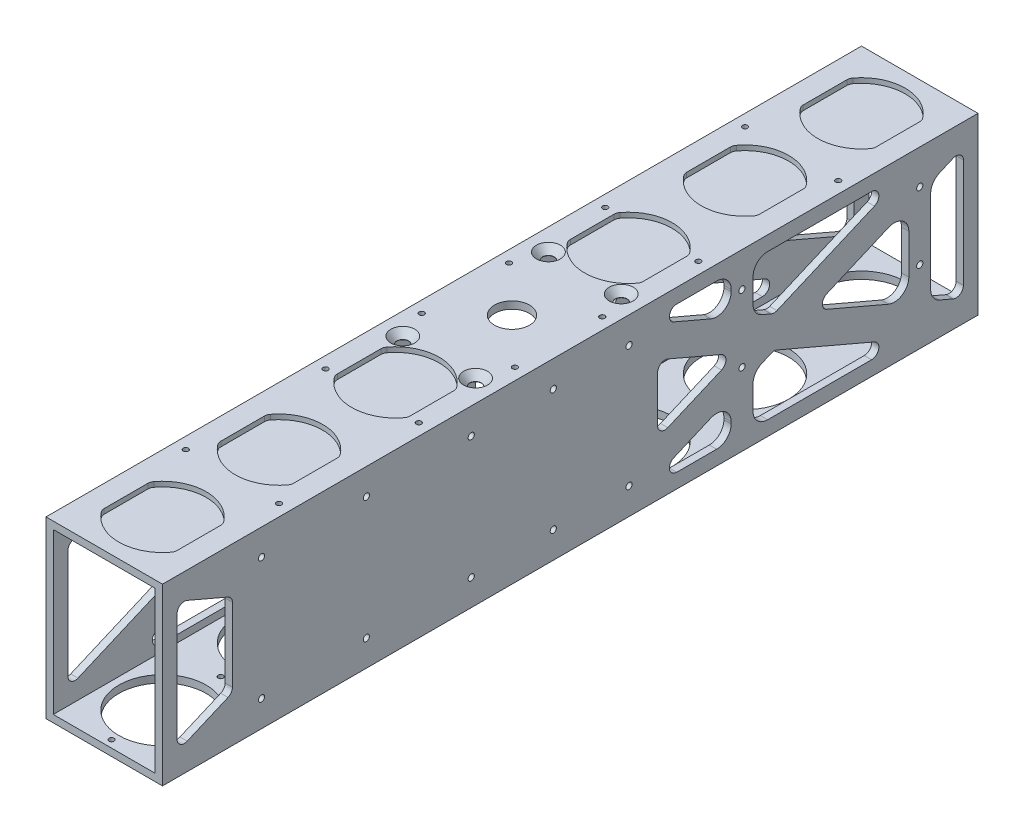
from build123d import *

# Parameters (mm, degrees)
SKETCH1_W                                   = 50.8
SKETCH1_H                                   = 76.2
SKETCH1_W_2                                 = 44.45
SKETCH1_H_2                                 = 69.85
BOSS_EXTRUDE1_DEPTH                         = 355.6
CUT_EXTRUDE2_DEPTH                          = 368.203540288
F_9_16_0_5625_DIAMETER_HOLE1_D              = 15.24
F_9_16_0_5625_DIAMETER_HOLE1_DEPTH          = 3.175
SKETCH6_R                                   = 19.05
CUT_EXTRUDE3_DEPTH                          = 368.203540288
CSK_FOR_10_FLAT_HEAD_SOCKET_CAP_SCR_2_COUNT = 2
CSK_FOR_10_FLAT_HEAD_SOCKET_CAP_SCR_2_PITCH = 31.75
CSK_FOR_10_FLAT_HEAD_SOCKET_CAP_SCR_3_COUNT = 2
CSK_FOR_10_FLAT_HEAD_SOCKET_CAP_SCR_3_PITCH = 63.5
CSK_FOR_10_FLAT_HEAD_SOCKET_CAP_SCR_4_COUNT = 2
CSK_FOR_10_FLAT_HEAD_SOCKET_CAP_SCR_4_PITCH = 70.995158286
CUT_EXTRUDE4_REACH                          = 369.204
SKETCH9_R                                   = 19.05
BOSS_EXTRUDE2_DEPTH                         = 3.175
FILLET1_R                                   = 3.175
F_6_32_TAPPED_HOLE1_D                       = 2.7051
F_6_32_TAPPED_HOLE1_DEPTH                   = 3.175
F_6_32_TAPPED_HOLE2_D                       = 2.7051
F_6_32_TAPPED_HOLE2_DEPTH                   = 3.175
BOSS_EXTRUDE7_DEPTH                         = 3.175
FILLET6_R                                   = 6.35
F_6_32_TAPPED_HOLE3_D                       = 2.7051
F_6_32_TAPPED_HOLE3_DEPTH                   = 9.398
F_6_32_TAPPED_HOLE3_TIP                     = 0.81269403
F_4_40_TAPPED_HOLE1_D                       = 2.2606
F_4_40_TAPPED_HOLE1_DEPTH                   = 3.175
BOSS_EXTRUDE8_DEPTH                         = 3.175
BOSS_EXTRUDE9_START                         = -1.016
BOSS_EXTRUDE9_DEPTH                         = 1.016
FILLET7_R                                   = 3.175
F_4_40_TAPPED_HOLE2_REACH                   = 369.204
F_4_40_TAPPED_HOLE2_BORE_R                  = 1.1303


with BuildPart() as part:
    # Sketch1 → Boss-Extrude1 (new body)
    with BuildSketch(Plane.XY):
        with Locations((25.4, 38.1)):
            Rectangle(SKETCH1_W, SKETCH1_H)
        with Locations((25.4, 38.1)):
            Rectangle(SKETCH1_W_2, SKETCH1_H_2, mode=Mode.SUBTRACT)
    extrude(amount=BOSS_EXTRUDE1_DEPTH)

    # Sketch2 → Cut-Extrude2 (cut, through all)
    with BuildSketch(Plane(origin=(50.8, 0, 0), x_dir=(0, 0, -1), z_dir=(1, 0, 0))):
        with BuildLine():
            Line((-171.45, 61.754965881), (-171.45, 14.445034119))
            ThreePointArc((-171.45, 14.445034119), (-170.022808953, 11.794413651), (-167.024306227, 11.526748649))
            Line((-167.024306227, 11.526748649), (-111.829385838, 35.18171453))
            ThreePointArc((-111.829385838, 35.18171453), (-109.905079611, 38.1), (-111.829385838, 41.01828547))
            Line((-111.829385838, 41.01828547), (-167.024306227, 64.673251351))
            ThreePointArc((-167.024306227, 64.673251351), (-170.022808953, 64.405586349), (-171.45, 61.754965881))
        make_face()
        with BuildLine():
            Line((-310.445614162, 63.75671453), (-267.950693773, 45.544605792))
            ThreePointArc((-267.950693773, 45.544605792), (-266.7, 45.287891262), (-265.449306227, 45.544605792))
            Line((-265.449306227, 45.544605792), (-222.954385838, 63.75671453))
            ThreePointArc((-222.954385838, 63.75671453), (-221.094920341, 67.313384144), (-224.205079611, 69.85))
            Line((-224.205079611, 69.85), (-309.194920389, 69.85))
            ThreePointArc((-309.194920389, 69.85), (-312.305079659, 67.313384144), (-310.445614162, 63.75671453))
        make_face()
        with BuildLine():
            Line((-344.824306227, 64.673251351), (-289.629385838, 41.01828547))
            ThreePointArc((-289.629385838, 41.01828547), (-287.705079611, 38.1), (-289.629385838, 35.18171453))
            Line((-289.629385838, 35.18171453), (-344.824306227, 11.526748649))
            ThreePointArc((-344.824306227, 11.526748649), (-347.822808953, 11.794413651), (-349.25, 14.445034119))
            Line((-349.25, 14.445034119), (-349.25, 61.754965881))
            ThreePointArc((-349.25, 61.754965881), (-347.822808953, 64.405586349), (-344.824306227, 64.673251351))
        make_face()
        with BuildLine():
            Line((-184.15, 61.754965881), (-184.15, 14.445034119))
            ThreePointArc((-184.15, 14.445034119), (-185.577191047, 11.794413651), (-188.575693773, 11.526748649))
            Line((-188.575693773, 11.526748649), (-243.770614162, 35.18171453))
            ThreePointArc((-243.770614162, 35.18171453), (-245.694920389, 38.1), (-243.770614162, 41.01828547))
            Line((-243.770614162, 41.01828547), (-188.575693773, 64.673251351))
            ThreePointArc((-188.575693773, 64.673251351), (-185.577191047, 64.405586349), (-184.15, 61.754965881))
        make_face()
        with BuildLine():
            Line((-45.154385838, 63.75671453), (-87.649306227, 45.544605792))
            ThreePointArc((-87.649306227, 45.544605792), (-88.9, 45.287891262), (-90.150693773, 45.544605792))
            Line((-90.150693773, 45.544605792), (-132.645614162, 63.75671453))
            ThreePointArc((-132.645614162, 63.75671453), (-134.505079659, 67.313384144), (-131.394920389, 69.85))
            Line((-131.394920389, 69.85), (-46.405079611, 69.85))
            ThreePointArc((-46.405079611, 69.85), (-43.294920341, 67.313384144), (-45.154385838, 63.75671453))
        make_face()
        with BuildLine():
            Line((-10.775693773, 64.673251351), (-65.970614162, 41.01828547))
            ThreePointArc((-65.970614162, 41.01828547), (-67.894920389, 38.1), (-65.970614162, 35.18171453))
            Line((-65.970614162, 35.18171453), (-10.775693773, 11.526748649))
            ThreePointArc((-10.775693773, 11.526748649), (-7.777191047, 11.794413651), (-6.35, 14.445034119))
            Line((-6.35, 14.445034119), (-6.35, 61.754965881))
            ThreePointArc((-6.35, 61.754965881), (-7.777191047, 64.405586349), (-10.775693773, 64.673251351))
        make_face()
        with BuildLine():
            Line((-309.194920389, 6.35), (-224.205079611, 6.35))
            ThreePointArc((-224.205079611, 6.35), (-221.094920341, 8.886615856), (-222.954385838, 12.44328547))
            Line((-222.954385838, 12.44328547), (-265.449306227, 30.655394208))
            ThreePointArc((-265.449306227, 30.655394208), (-266.7, 30.912108738), (-267.950693773, 30.655394208))
            Line((-267.950693773, 30.655394208), (-310.445614162, 12.44328547))
            ThreePointArc((-310.445614162, 12.44328547), (-312.305079659, 8.886615856), (-309.194920389, 6.35))
        make_face()
        with BuildLine():
            Line((-87.649306227, 30.655394208), (-45.154385838, 12.44328547))
            ThreePointArc((-45.154385838, 12.44328547), (-43.294920341, 8.886615856), (-46.405079611, 6.35))
            Line((-46.405079611, 6.35), (-131.394920389, 6.35))
            ThreePointArc((-131.394920389, 6.35), (-134.505079659, 8.886615856), (-132.645614162, 12.44328547))
            Line((-132.645614162, 12.44328547), (-90.150693773, 30.655394208))
            ThreePointArc((-90.150693773, 30.655394208), (-88.9, 30.912108738), (-87.649306227, 30.655394208))
        make_face()
    extrude(amount=-CUT_EXTRUDE2_DEPTH, mode=Mode.SUBTRACT)

    # 9/16 (0.5625) Diameter Hole1
    with Locations(Plane(origin=(0, 76.2, 0), x_dir=(-1, 0, 0), z_dir=(0, 1, 0))):
        with Locations((-25.4, 177.8)):
            Hole(F_9_16_0_5625_DIAMETER_HOLE1_D / 2, depth=F_9_16_0_5625_DIAMETER_HOLE1_DEPTH)

    # Sketch6 → Cut-Extrude3 (cut, through all)
    with BuildSketch(Plane(origin=(0, 76.2, 0), x_dir=(1, 0, 0), z_dir=(0, 1, 0))):
        with Locations(Location((25.4, -25.4, 0), (0, 0, 270))):
            Circle(SKETCH6_R)
        with Locations(Location((25.4, -76.2, 0), (0, 0, 270))):
            Circle(SKETCH6_R)
        with Locations(Location((25.4, -127, 0), (0, 0, 270))):
            Circle(SKETCH6_R)
        with Locations(Location((25.4, -228.6, 0), (0, 0, 270))):
            Circle(SKETCH6_R)
        with Locations(Location((25.4, -279.4, 0), (0, 0, 270))):
            Circle(SKETCH6_R)
        with Locations(Location((25.4, -330.2, 0), (0, 0, 270))):
            Circle(SKETCH6_R)
    extrude(amount=-CUT_EXTRUDE3_DEPTH, mode=Mode.SUBTRACT)

    # Sketch7 → CSK for #10 Flat Head Socket Cap Screw1 (revolve, cut)
    with BuildSketch(Plane(origin=(41.275, 76.2, 146.05), x_dir=(0, 0, 1), z_dir=(1, 0, 0))):
        Polygon((0, 0), (0, 3.175), (2.5527, 3.175), (2.5527, 3.068032542), (5.2197, 0), align=None)
    csk_for_10_flat_head_socket_cap_screw1 = revolve(axis=Axis((41.275, 82.55, 146.05), (0, -1, 0)), mode=Mode.SUBTRACT)

    # CSK for _10 Flat Head Socket Cap Scr 2: CSK for #10 Flat Head Socket Cap Screw1 ×2
    with Locations(*[(-i * CSK_FOR_10_FLAT_HEAD_SOCKET_CAP_SCR_2_PITCH, 0, 0) for i in range(1, CSK_FOR_10_FLAT_HEAD_SOCKET_CAP_SCR_2_COUNT)]):
        add(csk_for_10_flat_head_socket_cap_screw1, mode=Mode.SUBTRACT)

    # CSK for _10 Flat Head Socket Cap Scr 3: CSK for #10 Flat Head Socket Cap Screw1 ×2
    with Locations(*[(0, 0, i * CSK_FOR_10_FLAT_HEAD_SOCKET_CAP_SCR_3_PITCH) for i in range(1, CSK_FOR_10_FLAT_HEAD_SOCKET_CAP_SCR_3_COUNT)]):
        add(csk_for_10_flat_head_socket_cap_screw1, mode=Mode.SUBTRACT)

    # CSK for _10 Flat Head Socket Cap Scr 4: CSK for #10 Flat Head Socket Cap Screw1 ×2
    with Locations(*[Vector(-0.447213595499958, 0, 0.894427190999916) * (i * CSK_FOR_10_FLAT_HEAD_SOCKET_CAP_SCR_4_PITCH) for i in range(1, CSK_FOR_10_FLAT_HEAD_SOCKET_CAP_SCR_4_COUNT)]):
        add(csk_for_10_flat_head_socket_cap_screw1, mode=Mode.SUBTRACT)

    # Sketch9 → Cut-Extrude4 (cut, up to next)
    with BuildSketch(Plane.XZ, mode=Mode.PRIVATE) as cut_extrude4_sk1:
        with Locations(Location((25.4, 177.8, 0), (0, 0, 270))):
            Circle(SKETCH9_R)
    cut_extrude4_tool1 = extrude(cut_extrude4_sk1.sketch, amount=-CUT_EXTRUDE4_REACH, mode=Mode.PRIVATE) & part.part
    add(cut_extrude4_tool1.solids().sort_by_distance((25.4, 0, 177.8))[0], mode=Mode.SUBTRACT)

    # Sketch10 → Boss-Extrude2 (add)
    with BuildSketch(Plane(origin=(50.8, 0, 0), x_dir=(0, 0, -1), z_dir=(1, 0, 0))):
        with BuildLine():
            Line((-325.12, 56.228548683), (-325.12, 19.971451317))
            Line((-325.12, 19.971451317), (-289.629385838, 35.18171453))
            ThreePointArc((-289.629385838, 35.18171453), (-287.705079611, 38.1), (-289.629385838, 41.01828547))
            Line((-289.629385838, 41.01828547), (-325.12, 56.228548683))
        make_face()
        with BuildLine():
            Line((-171.45, 9.630022746), (-171.45, 4.187165603))
            Line((-171.45, 4.187165603), (-243.770614162, 35.18171453))
            ThreePointArc((-243.770614162, 35.18171453), (-245.694920389, 38.1), (-243.770614162, 41.01828547))
            Line((-243.770614162, 41.01828547), (-167.024306227, 73.9095603))
            Line((-167.024306227, 73.9095603), (-167.024306227, 64.673251351))
            Line((-167.024306227, 64.673251351), (-139.7, 52.962834397))
            Line((-139.7, 52.962834397), (-139.7, 23.237165603))
            Line((-139.7, 23.237165603), (-171.45, 9.630022746))
        make_face()
        with BuildLine():
            Line((-310.445614162, 63.75671453), (-267.950693773, 45.544605792))
            ThreePointArc((-267.950693773, 45.544605792), (-266.7, 45.287891262), (-265.449306227, 45.544605792))
            Line((-265.449306227, 45.544605792), (-222.954385838, 63.75671453))
            ThreePointArc((-222.954385838, 63.75671453), (-221.094920341, 67.313384144), (-224.205079611, 69.85))
            Line((-224.205079611, 69.85), (-309.194920389, 69.85))
            ThreePointArc((-309.194920389, 69.85), (-312.305079659, 67.313384144), (-310.445614162, 63.75671453))
        make_face()
        with BuildLine():
            Line((-222.954385838, 12.44328547), (-265.449306227, 30.655394208))
            ThreePointArc((-265.449306227, 30.655394208), (-266.7, 30.912108738), (-267.950693773, 30.655394208))
            Line((-267.950693773, 30.655394208), (-310.445614162, 12.44328547))
            ThreePointArc((-310.445614162, 12.44328547), (-312.305079659, 8.886615856), (-309.194920389, 6.35))
            Line((-309.194920389, 6.35), (-224.205079611, 6.35))
            ThreePointArc((-224.205079611, 6.35), (-221.094920341, 8.886615856), (-222.954385838, 12.44328547))
        make_face()
    extrude(amount=-BOSS_EXTRUDE2_DEPTH)

    # Fillet1
    fillet1_edges = [part.edges().sort_by_distance(p)[0] for p in [
        (49.2125, 23.237165603, 139.7),
        (49.2125, 52.962834397, 139.7),
        (49.2125, 56.228548683, 325.12),
        (49.2125, 19.971451317, 325.12),
    ]]
    fillet(fillet1_edges, radius=FILLET1_R)

    # #6-32 Tapped Hole1
    with Locations(Plane(origin=(50.8, 0, 0), x_dir=(0, 0, -1), z_dir=(1, 0, 0))):
        with Locations((-312.42, 64.77), (-266.7, 64.77), (-220.98, 64.77), (-220.98, 11.43), (-266.7, 11.43), (-312.42, 11.43)):
            Hole(F_6_32_TAPPED_HOLE1_D / 2, depth=F_6_32_TAPPED_HOLE1_DEPTH)

    # #6-32 Tapped Hole2
    with Locations(Plane(origin=(50.8, 0, 0), x_dir=(0, 0, -1), z_dir=(1, 0, 0))):
        with Locations((-152.1714, 64.6303), (-185.1914, 64.6303), (-185.1914, 11.5697), (-152.1714, 11.5697)):
            Hole(F_6_32_TAPPED_HOLE2_D / 2, depth=F_6_32_TAPPED_HOLE2_DEPTH)

    # Sketch20 → Boss-Extrude7 (add)
    with BuildSketch(Plane(origin=(50.8, 0, 0), x_dir=(0, 0, -1), z_dir=(1, 0, 0))):
        Polygon((-107.6325, 69.85), (-107.6325, 53.03680846), (-98.1075, 48.954665603), (-98.1075, 69.85), align=None)
        Polygon((-30.1625, 56.364620111), (-30.1625, 19.835379889), (-20.6375, 15.753237032), (-20.6375, 60.446762968), align=None)
        Polygon((-98.1075, 27.245334397), (-107.6325, 23.16319154), (-107.6325, 6.35), (-98.1075, 6.35), align=None)
    extrude(amount=-BOSS_EXTRUDE7_DEPTH)

    # Fillet6
    fillet6_edges = [part.edges().sort_by_distance(p)[0] for p in [
        (49.2125, 53.03680846, 107.6325),
        (49.2125, 48.954665603, 98.1075),
        (49.2125, 69.85, 98.1075),
        (49.2125, 69.85, 107.6325),
        (49.2125, 6.35, 98.1075),
        (49.2125, 27.245334397, 98.1075),
        (49.2125, 23.16319154, 107.6325),
        (49.2125, 6.35, 107.6325),
        (49.2125, 60.446762968, 20.6375),
        (49.2125, 56.364620111, 30.1625),
        (49.2125, 19.835379889, 30.1625),
        (49.2125, 15.753237032, 20.6375),
    ]]
    fillet(fillet6_edges, radius=FILLET6_R)

    # #6-32 Tapped Hole3
    with Locations(Plane(origin=(50.8, 0, 0), x_dir=(0, 0, -1), z_dir=(1, 0, 0))):
        with Locations((-102.9, 61.1), (-25.4, 61.1), (-25.4, 31.75), (-102.9, 31.75)):
            Hole(F_6_32_TAPPED_HOLE3_D / 2, depth=F_6_32_TAPPED_HOLE3_DEPTH)
            with Locations((0, 0, -(F_6_32_TAPPED_HOLE3_DEPTH + F_6_32_TAPPED_HOLE3_TIP / 2))):  # 118° drill point
                Cone(0, F_6_32_TAPPED_HOLE3_D / 2, F_6_32_TAPPED_HOLE3_TIP, mode=Mode.SUBTRACT)

    # #4-40 Tapped Hole1
    with Locations(Plane.XZ):
        with Locations((25.4, 304.8), (25.4, 352.425), (25.4, 254), (25.4, 203.2), (25.4, 152.4), (25.4, 101.6), (25.4, 50.8), (25.4, 3.175)):
            Hole(F_4_40_TAPPED_HOLE1_D / 2, depth=F_4_40_TAPPED_HOLE1_DEPTH)

    # Sketch29 → Boss-Extrude8 (add)
    with BuildSketch(Plane(origin=(0, 76.2, 0), x_dir=(1, 0, 0), z_dir=(0, 1, 0))):
        with BuildLine():
            Line((9.525, -14.869716291), (9.525, -35.930283709))
            ThreePointArc((9.525, -35.930283709), (6.35, -25.4), (9.525, -14.869716291))
        make_face()
        with BuildLine():
            Line((41.275, -14.869716291), (41.275, -35.930283709))
            ThreePointArc((41.275, -35.930283709), (44.45, -25.4), (41.275, -14.869716291))
        make_face()
        with BuildLine():
            Line((41.275, -116.469716291), (41.275, -137.530283709))
            ThreePointArc((41.275, -137.530283709), (44.45, -127), (41.275, -116.469716291))
        make_face()
        with BuildLine():
            Line((9.525, -116.469716291), (9.525, -137.530283709))
            ThreePointArc((9.525, -137.530283709), (6.35, -127), (9.525, -116.469716291))
        make_face()
        with BuildLine():
            Line((41.275, -65.669716291), (41.275, -86.730283709))
            ThreePointArc((41.275, -86.730283709), (44.45, -76.2), (41.275, -65.669716291))
        make_face()
        with BuildLine():
            Line((9.525, -65.669716291), (9.525, -86.730283709))
            ThreePointArc((9.525, -86.730283709), (6.35, -76.2), (9.525, -65.669716291))
        make_face()
        with BuildLine():
            Line((41.275, -218.069716291), (41.275, -239.130283709))
            ThreePointArc((41.275, -239.130283709), (44.45, -228.6), (41.275, -218.069716291))
        make_face()
        with BuildLine():
            Line((9.525, -218.069716291), (9.525, -239.130283709))
            ThreePointArc((9.525, -239.130283709), (6.35, -228.6), (9.525, -218.069716291))
        make_face()
        with BuildLine():
            Line((41.275, -268.869716291), (41.275, -289.930283709))
            ThreePointArc((41.275, -289.930283709), (44.45, -279.4), (41.275, -268.869716291))
        make_face()
        with BuildLine():
            Line((9.525, -268.869716291), (9.525, -289.930283709))
            ThreePointArc((9.525, -289.930283709), (6.35, -279.4), (9.525, -268.869716291))
        make_face()
        with BuildLine():
            Line((41.275, -319.669716291), (41.275, -340.730283709))
            ThreePointArc((41.275, -340.730283709), (44.45, -330.2), (41.275, -319.669716291))
        make_face()
        with BuildLine():
            Line((9.525, -319.669716291), (9.525, -340.730283709))
            ThreePointArc((9.525, -340.730283709), (6.35, -330.2), (9.525, -319.669716291))
        make_face()
    extrude(amount=-BOSS_EXTRUDE8_DEPTH)

    # Sketch30 → Boss-Extrude9 (add)
    with BuildSketch(Plane.XZ.offset(-73.025).offset(BOSS_EXTRUDE9_START)):
        with BuildLine():
            Line((9.525, 340.730283709), (9.525, 319.669716291))
            ThreePointArc((9.525, 319.669716291), (25.4, 311.15), (41.275, 319.669716291))
            Line((41.275, 319.669716291), (41.275, 340.730283709))
            ThreePointArc((41.275, 340.730283709), (25.4, 349.25), (9.525, 340.730283709))
        make_face()
        with BuildLine():
            Line((9.525, 289.930283709), (9.525, 268.869716291))
            ThreePointArc((9.525, 268.869716291), (25.4, 260.35), (41.275, 268.869716291))
            Line((41.275, 268.869716291), (41.275, 289.930283709))
            ThreePointArc((41.275, 289.930283709), (25.4, 298.45), (9.525, 289.930283709))
        make_face()
        with BuildLine():
            Line((41.275, 218.069716291), (41.275, 239.130283709))
            ThreePointArc((41.275, 239.130283709), (25.4, 247.65), (9.525, 239.130283709))
            Line((9.525, 239.130283709), (9.525, 218.069716291))
            ThreePointArc((9.525, 218.069716291), (25.4, 209.55), (41.275, 218.069716291))
        make_face()
        with BuildLine():
            Line((9.525, 137.530283709), (9.525, 116.469716291))
            ThreePointArc((9.525, 116.469716291), (25.4, 107.95), (41.275, 116.469716291))
            Line((41.275, 116.469716291), (41.275, 137.530283709))
            ThreePointArc((41.275, 137.530283709), (25.4, 146.05), (9.525, 137.530283709))
        make_face()
        with BuildLine():
            Line((9.525, 86.730283709), (9.525, 65.669716291))
            ThreePointArc((9.525, 65.669716291), (25.4, 57.15), (41.275, 65.669716291))
            Line((41.275, 65.669716291), (41.275, 86.730283709))
            ThreePointArc((41.275, 86.730283709), (25.4, 95.25), (9.525, 86.730283709))
        make_face()
        with BuildLine():
            Line((41.275, 14.869716291), (41.275, 35.930283709))
            ThreePointArc((41.275, 35.930283709), (25.4, 44.45), (9.525, 35.930283709))
            Line((9.525, 35.930283709), (9.525, 14.869716291))
            ThreePointArc((9.525, 14.869716291), (25.4, 6.35), (41.275, 14.869716291))
        make_face()
    extrude(amount=BOSS_EXTRUDE9_DEPTH)

    # Fillet7
    fillet7_edges = [part.edges().sort_by_distance(p)[0] for p in [
        (41.275, 75.1205, 319.669716291),
        (41.275, 75.1205, 340.730283709),
        (9.525, 75.1205, 340.730283709),
        (9.525, 75.1205, 319.669716291),
        (41.275, 75.1205, 268.869716291),
        (41.275, 75.1205, 289.930283709),
        (9.525, 75.1205, 289.930283709),
        (9.525, 75.1205, 268.869716291),
        (9.525, 75.1205, 239.130283709),
        (9.525, 75.1205, 218.069716291),
        (41.275, 75.1205, 218.069716291),
        (41.275, 75.1205, 239.130283709),
        (41.275, 75.1205, 116.469716291),
        (41.275, 75.1205, 137.530283709),
        (9.525, 75.1205, 137.530283709),
        (9.525, 75.1205, 116.469716291),
        (41.275, 75.1205, 65.669716291),
        (41.275, 75.1205, 86.730283709),
        (9.525, 75.1205, 86.730283709),
        (9.525, 75.1205, 65.669716291),
        (9.525, 75.1205, 35.930283709),
        (9.525, 75.1205, 14.869716291),
        (41.275, 75.1205, 14.869716291),
        (41.275, 75.1205, 35.930283709),
    ]]
    fillet(fillet7_edges, radius=FILLET7_R)

    # #4-40 Tapped Hole2 bore → #4-40 Tapped Hole2 (cut, up to next)
    with BuildSketch(Plane(origin=(0, 76.2, 0), x_dir=(-1, 0, 0), z_dir=(0, 1, 0)), mode=Mode.PRIVATE) as f_4_40_tapped_hole2_sk1:
        with Locations((-45.72, 299.72)):
            Circle(F_4_40_TAPPED_HOLE2_BORE_R)
    f_4_40_tapped_hole2_tool1 = extrude(f_4_40_tapped_hole2_sk1.sketch, amount=-F_4_40_TAPPED_HOLE2_REACH, mode=Mode.PRIVATE) & part.part
    # #4-40 Tapped Hole2 bore → #4-40 Tapped Hole2 (cut, up to next)
    with BuildSketch(Plane(origin=(0, 76.2, 0), x_dir=(-1, 0, 0), z_dir=(0, 1, 0)), mode=Mode.PRIVATE) as f_4_40_tapped_hole2_sk2:
        with Locations((-45.72, 238.76)):
            Circle(F_4_40_TAPPED_HOLE2_BORE_R)
    f_4_40_tapped_hole2_tool2 = extrude(f_4_40_tapped_hole2_sk2.sketch, amount=-F_4_40_TAPPED_HOLE2_REACH, mode=Mode.PRIVATE) & part.part
    # #4-40 Tapped Hole2 bore → #4-40 Tapped Hole2 (cut, up to next)
    with BuildSketch(Plane(origin=(0, 76.2, 0), x_dir=(-1, 0, 0), z_dir=(0, 1, 0)), mode=Mode.PRIVATE) as f_4_40_tapped_hole2_sk3:
        with Locations((-45.72, 116.84)):
            Circle(F_4_40_TAPPED_HOLE2_BORE_R)
    f_4_40_tapped_hole2_tool3 = extrude(f_4_40_tapped_hole2_sk3.sketch, amount=-F_4_40_TAPPED_HOLE2_REACH, mode=Mode.PRIVATE) & part.part
    # #4-40 Tapped Hole2 bore → #4-40 Tapped Hole2 (cut, up to next)
    with BuildSketch(Plane(origin=(0, 76.2, 0), x_dir=(-1, 0, 0), z_dir=(0, 1, 0)), mode=Mode.PRIVATE) as f_4_40_tapped_hole2_sk4:
        with Locations((-45.72, 55.88)):
            Circle(F_4_40_TAPPED_HOLE2_BORE_R)
    f_4_40_tapped_hole2_tool4 = extrude(f_4_40_tapped_hole2_sk4.sketch, amount=-F_4_40_TAPPED_HOLE2_REACH, mode=Mode.PRIVATE) & part.part
    # #4-40 Tapped Hole2 bore → #4-40 Tapped Hole2 (cut, up to next)
    with BuildSketch(Plane(origin=(0, 76.2, 0), x_dir=(-1, 0, 0), z_dir=(0, 1, 0)), mode=Mode.PRIVATE) as f_4_40_tapped_hole2_sk5:
        with Locations((-45.72, 158.75)):
            Circle(F_4_40_TAPPED_HOLE2_BORE_R)
    f_4_40_tapped_hole2_tool5 = extrude(f_4_40_tapped_hole2_sk5.sketch, amount=-F_4_40_TAPPED_HOLE2_REACH, mode=Mode.PRIVATE) & part.part
    # #4-40 Tapped Hole2 bore → #4-40 Tapped Hole2 (cut, up to next)
    with BuildSketch(Plane(origin=(0, 76.2, 0), x_dir=(-1, 0, 0), z_dir=(0, 1, 0)), mode=Mode.PRIVATE) as f_4_40_tapped_hole2_sk6:
        with Locations((-45.72, 196.85)):
            Circle(F_4_40_TAPPED_HOLE2_BORE_R)
    f_4_40_tapped_hole2_tool6 = extrude(f_4_40_tapped_hole2_sk6.sketch, amount=-F_4_40_TAPPED_HOLE2_REACH, mode=Mode.PRIVATE) & part.part
    f_4_40_tapped_hole2_1 = f_4_40_tapped_hole2_tool1.solids().sort_by_distance((45.72, 76.2, 299.72))[0]
    add(f_4_40_tapped_hole2_1, mode=Mode.SUBTRACT)
    f_4_40_tapped_hole2_2 = f_4_40_tapped_hole2_tool2.solids().sort_by_distance((45.72, 76.2, 238.76))[0]
    add(f_4_40_tapped_hole2_2, mode=Mode.SUBTRACT)
    f_4_40_tapped_hole2_3 = f_4_40_tapped_hole2_tool3.solids().sort_by_distance((45.72, 76.2, 116.84))[0]
    add(f_4_40_tapped_hole2_3, mode=Mode.SUBTRACT)
    f_4_40_tapped_hole2_4 = f_4_40_tapped_hole2_tool4.solids().sort_by_distance((45.72, 76.2, 55.88))[0]
    add(f_4_40_tapped_hole2_4, mode=Mode.SUBTRACT)
    f_4_40_tapped_hole2_5 = f_4_40_tapped_hole2_tool5.solids().sort_by_distance((45.72, 76.2, 158.75))[0]
    add(f_4_40_tapped_hole2_5, mode=Mode.SUBTRACT)
    f_4_40_tapped_hole2_6 = f_4_40_tapped_hole2_tool6.solids().sort_by_distance((45.72, 76.2, 196.85))[0]
    add(f_4_40_tapped_hole2_6, mode=Mode.SUBTRACT)
    f_4_40_tapped_hole2 = f_4_40_tapped_hole2_1 + f_4_40_tapped_hole2_2 + f_4_40_tapped_hole2_3 + f_4_40_tapped_hole2_4 + f_4_40_tapped_hole2_5 + f_4_40_tapped_hole2_6  # #4-40 Tapped Hole2 as one shape, for the pattern or mirror that repeats it

    # Mirror1: #4-40 Tapped Hole2 across plane
    add(f_4_40_tapped_hole2.mirror(Plane(origin=(25.4, 0, 0), x_dir=(0, 0, 1), z_dir=(1, 0, 0))), mode=Mode.SUBTRACT)


solid = part.part
